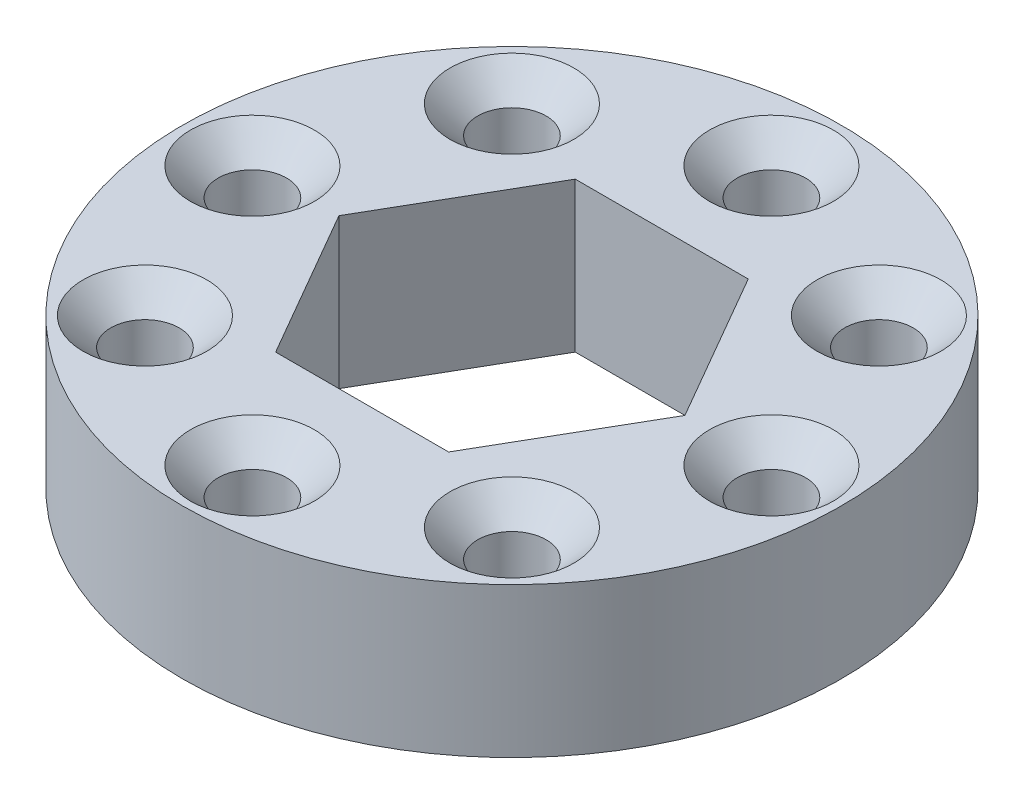
from build123d import *

# Parameters (mm, degrees)
SKETCH1_R                        = 13.97
BOSS_EXTRUDE1_DEPTH              = 3.175
M2_5_CLEARANCE_HOLE1_D           = 2.9
M2_5_CLEARANCE_HOLE1_CSINK_D     = 5.25
M2_5_CLEARANCE_HOLE1_CSINK_ANGLE = 90
CIRPATTERN1_COUNT                = 8


with BuildPart() as part:
    # Sketch1 → Boss-Extrude1 (new, symmetric)
    with BuildSketch(Plane(origin=(0, 0, 0), x_dir=(1, 0, 0), z_dir=(0, 1, 0))):
        with Locations(Location((0, 0, 0), (0, 0, 270))):
            Circle(SKETCH1_R)
        Polygon((3.666174209, 6.35), (-3.666174209, 6.35), (-7.332348419, 0), (-3.666174209, -6.35), (3.666174209, -6.35), (7.332348419, 0), align=None, mode=Mode.SUBTRACT)
    extrude(amount=BOSS_EXTRUDE1_DEPTH, both=True)

    # M2.5 Clearance Hole1 (through all)
    with Locations(Plane(origin=(0, 3.175, 0), x_dir=(1, 0, 0), z_dir=(0, 1, 0))):
        with Locations((0, 11)):
            m2_5_clearance_hole1 = CounterSinkHole(M2_5_CLEARANCE_HOLE1_D / 2, M2_5_CLEARANCE_HOLE1_CSINK_D / 2, counter_sink_angle=M2_5_CLEARANCE_HOLE1_CSINK_ANGLE)

    # CirPattern1: M2.5 Clearance Hole1 ×8 about axis
    cirpattern1_axis = Axis((0, 0, 0), (0, 1, 0))
    for i in range(1, CIRPATTERN1_COUNT):
        add(m2_5_clearance_hole1.rotate(cirpattern1_axis, i * 360 / CIRPATTERN1_COUNT), mode=Mode.SUBTRACT)


solid = part.part
